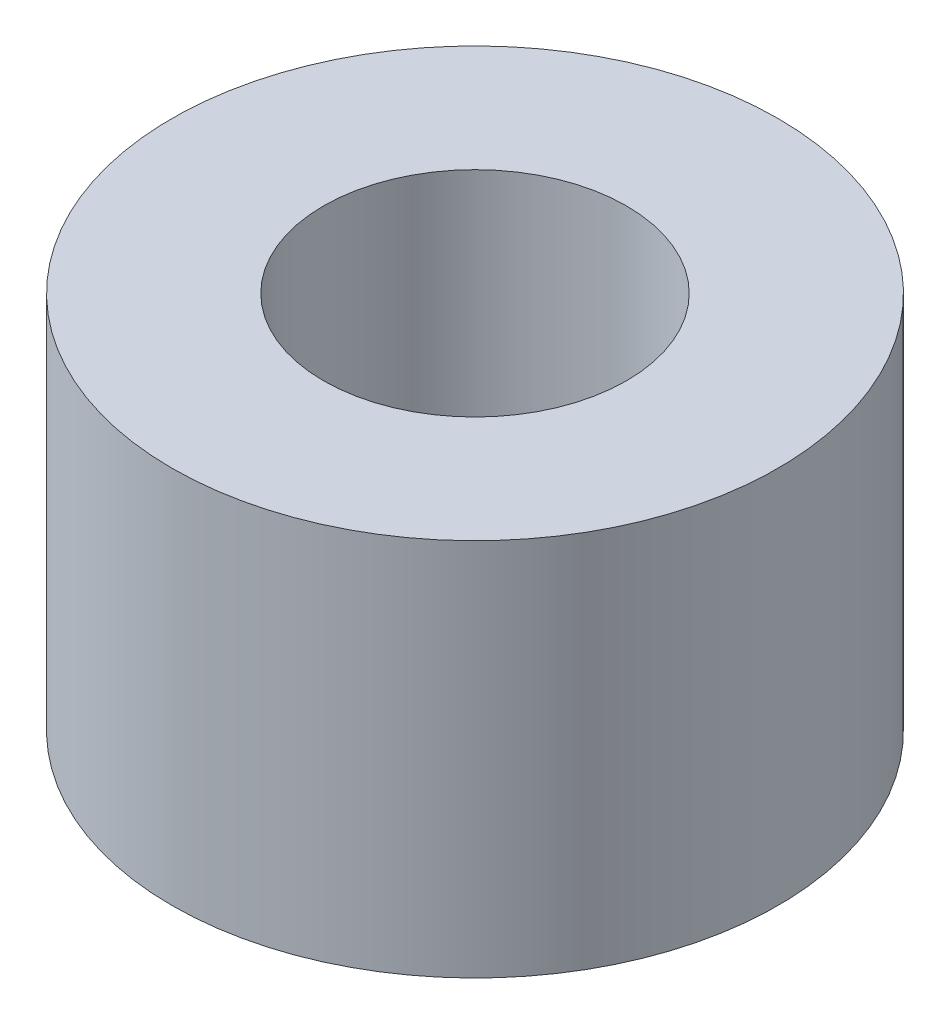
from build123d import *

# Parameters (mm, degrees)
SKETCH_1_R      = 4
SKETCH_1_R_2    = 2
EXTRUDE_1_DEPTH = 5


with BuildPart() as part:
    # 草图1 → 凸台-拉伸1 (new body)
    with BuildSketch(Plane(origin=(0, 0, 0), x_dir=(1, 0, 0), z_dir=(0, 1, 0))):
        with Locations(Location((0, 0, 0), (0, 0, 270))):
            Circle(SKETCH_1_R)
        with Locations(Location((0, 0, 0), (0, 0, 270))):
            Circle(SKETCH_1_R_2, mode=Mode.SUBTRACT)
    extrude(amount=EXTRUDE_1_DEPTH)


solid = part.part
